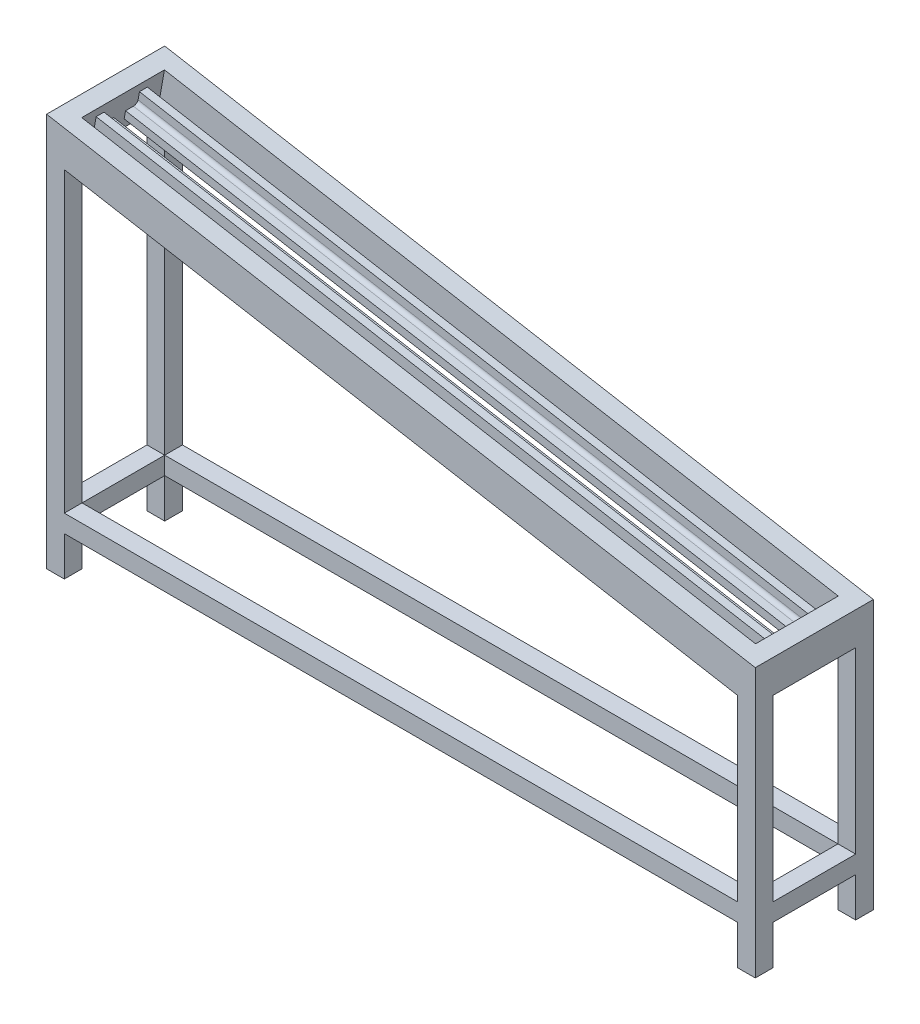
from build123d import *

# Parameters (mm, degrees)
RESSALTO_EXTRUS_O1_DEPTH = 300
ESBO_O2_W                = 1710
ESBO_O2_H                = 100
CORTE_EXTRUS_O1_DEPTH    = 300
CORTE_EXTRUS_O2_START    = -1800
ESBO_O3_W                = 210
ESBO_O3_H                = 454.157753787
ESBO_O3_H_2              = 100
CORTE_EXTRUS_O2_DEPTH    = 1800
ESBO_O4_W                = 1710
ESBO_O4_H                = 210
CORTE_EXTRUS_O3_DEPTH    = 45
ESBO_O5_W                = 210
ESBO_O5_H                = 301.519137011
CORTE_EXTRUS_O4_DEPTH    = 45
ESBO_O6_W                = 1737.767901394
ESBO_O6_H                = 210
CORTE_EXTRUS_O5_DEPTH    = 150
RESSALTO_EXTRUS_O2_DEPTH = 1737.767901394
FILETE1_R                = 10


with BuildPart() as part:
    # Esboço1 → Ressalto-extrusão1 (new body)
    with BuildSketch(Plane.XY):
        Polygon((0, 1000), (0, 0), (1800, 0), (1800, 682.611434725), align=None)
    extrude(amount=RESSALTO_EXTRUS_O1_DEPTH)

    # Esboço2 → Corte-extrusão1 (cut)
    with BuildSketch(Plane.XY.offset(300)):
        with Locations((900, 50)):
            Rectangle(ESBO_O2_W, ESBO_O2_H)
        Polygon((45, 900.676890798), (45, 145), (1755, 145), (1755, 599.157753787), align=None)
    extrude(amount=-CORTE_EXTRUS_O1_DEPTH, mode=Mode.SUBTRACT)

    # Esboço3 → Corte-extrusão2 (cut)
    with BuildSketch(Plane(origin=(1800, 0, 0), x_dir=(0, 0, -1), z_dir=(1, 0, 0)).offset(CORTE_EXTRUS_O2_START)):
        with Locations((-150, 372.078876894)):
            Rectangle(ESBO_O3_W, ESBO_O3_H)
        with Locations((-150, 50)):
            Rectangle(ESBO_O3_W, ESBO_O3_H_2)
    extrude(amount=CORTE_EXTRUS_O2_DEPTH, mode=Mode.SUBTRACT)

    # Esboço4 → Corte-extrusão3 (cut)
    with BuildSketch(Plane(origin=(0, 145, 0), x_dir=(1, 0, 0), z_dir=(0, 1, 0))):
        with Locations((900, -150)):
            Rectangle(ESBO_O4_W, ESBO_O4_H)
    extrude(amount=-CORTE_EXTRUS_O3_DEPTH, mode=Mode.SUBTRACT)

    # Esboço5 → Corte-extrusão4 (cut)
    with BuildSketch(Plane(origin=(45, 0, 0), x_dir=(0, 0, -1), z_dir=(1, 0, 0))):
        with Locations((-150, 749.917322293)):
            Rectangle(ESBO_O5_W, ESBO_O5_H)
    extrude(amount=-CORTE_EXTRUS_O4_DEPTH, mode=Mode.SUBTRACT)

    # Esboço6 → Corte-extrusão5 (cut)
    with BuildSketch(Plane(origin=(171.010071663, 969.846310393, 0), x_dir=(0.9848077530122075, -0.17364817766693394, 0), z_dir=(0.17364817766693397, 0.9848077530122076, 0))):
        with Locations((740.23577303, -150)):
            Rectangle(ESBO_O6_W, ESBO_O6_H)
    extrude(amount=-CORTE_EXTRUS_O5_DEPTH, mode=Mode.SUBTRACT)

    # Esboço8 → Ressalto-extrusão2 (add)
    with BuildSketch(Plane(origin=(-126.693722777, 22.339521612, 0), x_dir=(0, 0, -1), z_dir=(0.9848077530122076, -0.173648177666934, 0))):
        Polygon((-215, 964.807753012), (-215, 914.807753012), (-165, 914.807753012), (-165, 934.807753012), (-195, 934.807753012), (-195, 964.807753012), align=None)
        Polygon((-135, 914.807753012), (-85, 914.807753012), (-85, 964.807753012), (-105, 964.807753012), (-105, 934.807753012), (-135, 934.807753012), align=None)
    extrude(amount=RESSALTO_EXTRUS_O2_DEPTH)

    # Filete1
    filete1_edges = [part.edges().sort_by_distance(p)[0] for p in [
        (891.317591116, 792.065329712, 195),
        (891.317591116, 792.065329712, 105),
    ]]
    fillet(filete1_edges, radius=FILETE1_R)


solid = part.part
